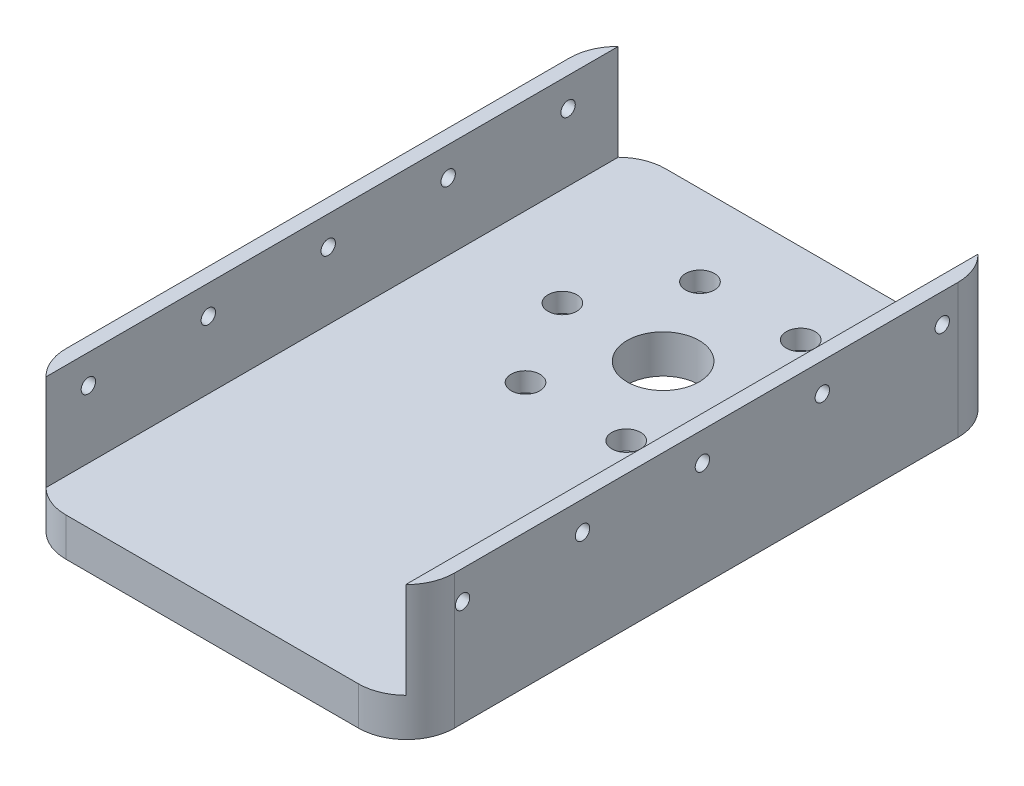
from build123d import *

# Parameters (mm, degrees)
SKETCH1_W           = 78
SKETCH1_H           = 125
BOSS_EXTRUDE1_DEPTH = 8
SKETCH2_R           = 7.5
SKETCH2_R_2         = 3
CUT_EXTRUDE1_DEPTH  = 4
SKETCH3_R           = 7.5
CUT_EXTRUDE2_DEPTH  = 148.39402973
SKETCH4_W           = 125
SKETCH4_H           = 20
SKETCH4_R           = 1.5
BOSS_EXTRUDE2_DEPTH = 3
SKETCH5_R           = 1.5
CUT_EXTRUDE3_DEPTH  = 149.690954668
SKETCH8_W           = 125
SKETCH8_H           = 28
BOSS_EXTRUDE3_DEPTH = 3
SKETCH9_R           = 1.5
CUT_EXTRUDE5_DEPTH  = 150.976664852
FILLET2_R           = 10


with BuildPart() as part:
    # Sketch1 → Boss-Extrude1 (new body)
    with BuildSketch(Plane(origin=(0, 0, 0), x_dir=(1, 0, 0), z_dir=(0, 1, 0))):
        with Locations((39, 62.5)):
            Rectangle(SKETCH1_W, SKETCH1_H)
    extrude(amount=BOSS_EXTRUDE1_DEPTH)

    # Sketch2 → Cut-Extrude1 (cut)
    with BuildSketch(Plane(origin=(0, 8, 0), x_dir=(-1, 0, 0), z_dir=(0, 1, 0))):
        with Locations(Location((-41.5, -90, 0), (0, 0, 90))):
            Circle(SKETCH2_R)
        with Locations(Location((-62.5, -90, 0), (0, 0, 90))):
            Circle(SKETCH2_R_2)
        with Locations(Location((-52, -71.813466521, 0), (0, 0, 90))):
            Circle(SKETCH2_R_2)
        with Locations(Location((-31, -71.813466521, 0), (0, 0, 90))):
            Circle(SKETCH2_R_2)
        with Locations(Location((-20.5, -90, 0), (0, 0, 90))):
            Circle(SKETCH2_R_2)
        with Locations(Location((-31, -108.186533479, 0), (0, 0, 90))):
            Circle(SKETCH2_R_2)
        with Locations(Location((-52, -108.186533479, 0), (0, 0, 90))):
            Circle(SKETCH2_R_2)
    extrude(amount=-CUT_EXTRUDE1_DEPTH, mode=Mode.SUBTRACT)

    # Sketch3 → Cut-Extrude2 (cut, through all)
    with BuildSketch(Plane(origin=(0, 4, 0), x_dir=(1, 0, 0), z_dir=(0, 1, 0))):
        with Locations(Location((41.5, 90, 0), (0, 0, 270))):
            Circle(SKETCH3_R)
    extrude(amount=-CUT_EXTRUDE2_DEPTH, mode=Mode.SUBTRACT)

    # Sketch4 → Boss-Extrude2 (add)
    with BuildSketch(Plane(origin=(78, 0, 0), x_dir=(0, 0, -1), z_dir=(1, 0, 0))):
        with Locations((62.5, 18)):
            Rectangle(SKETCH4_W, SKETCH4_H)
        with Locations((11.692170277, 22)):
            Circle(SKETCH4_R, mode=Mode.SUBTRACT)
        with Locations((36.692170277, 22)):
            Circle(SKETCH4_R, mode=Mode.SUBTRACT)
        with Locations((61.692170277, 22)):
            Circle(SKETCH4_R, mode=Mode.SUBTRACT)
        with Locations((86.692170277, 22)):
            Circle(SKETCH4_R, mode=Mode.SUBTRACT)
        with Locations((111.692170277, 22)):
            Circle(SKETCH4_R, mode=Mode.SUBTRACT)
    extrude(amount=-BOSS_EXTRUDE2_DEPTH)

    # Sketch5 → Cut-Extrude3 (cut, through all)
    with BuildSketch(Plane(origin=(0, 8, 0), x_dir=(-1, 0, 0), z_dir=(0, 1, 0))):
        with Locations(Location((-62.5, -90, 0), (0, 0, 90))):
            Circle(SKETCH5_R)
        with Locations(Location((-52, -71.813466521, 0), (0, 0, 90))):
            Circle(SKETCH5_R)
        with Locations(Location((-31, -71.813466521, 0), (0, 0, 90))):
            Circle(SKETCH5_R)
        with Locations(Location((-20.5, -90, 0), (0, 0, 90))):
            Circle(SKETCH5_R)
        with Locations(Location((-31, -108.186533479, 0), (0, 0, 90))):
            Circle(SKETCH5_R)
        with Locations(Location((-52, -108.186533479, 0), (0, 0, 90))):
            Circle(SKETCH5_R)
    extrude(amount=-CUT_EXTRUDE3_DEPTH, mode=Mode.SUBTRACT)

    # Sketch8 → Boss-Extrude3 (add)
    with BuildSketch(Plane.ZY):
        with Locations((-62.5, 14)):
            Rectangle(SKETCH8_W, SKETCH8_H)
    extrude(amount=BOSS_EXTRUDE3_DEPTH)

    # Sketch9 → Cut-Extrude5 (cut, through all)
    with BuildSketch(Plane(origin=(0, 0, 0), x_dir=(0, 0, -1), z_dir=(1, 0, 0))):
        with Locations((11.692170277, 22)):
            Circle(SKETCH9_R)
        with Locations((36.692170277, 22)):
            Circle(SKETCH9_R)
        with Locations((61.692170277, 22)):
            Circle(SKETCH9_R)
        with Locations((86.692170277, 22)):
            Circle(SKETCH9_R)
        with Locations((111.692170277, 22)):
            Circle(SKETCH9_R)
    extrude(amount=-CUT_EXTRUDE5_DEPTH, mode=Mode.SUBTRACT)

    # Fillet2
    fillet2_edges = [part.edges().sort_by_distance(p)[0] for p in [
        (-3, 14, -125),
        (78, 14, -125),
        (78, 14, 0),
        (-3, 14, 0),
    ]]
    fillet(fillet2_edges, radius=FILLET2_R)


solid = part.part
